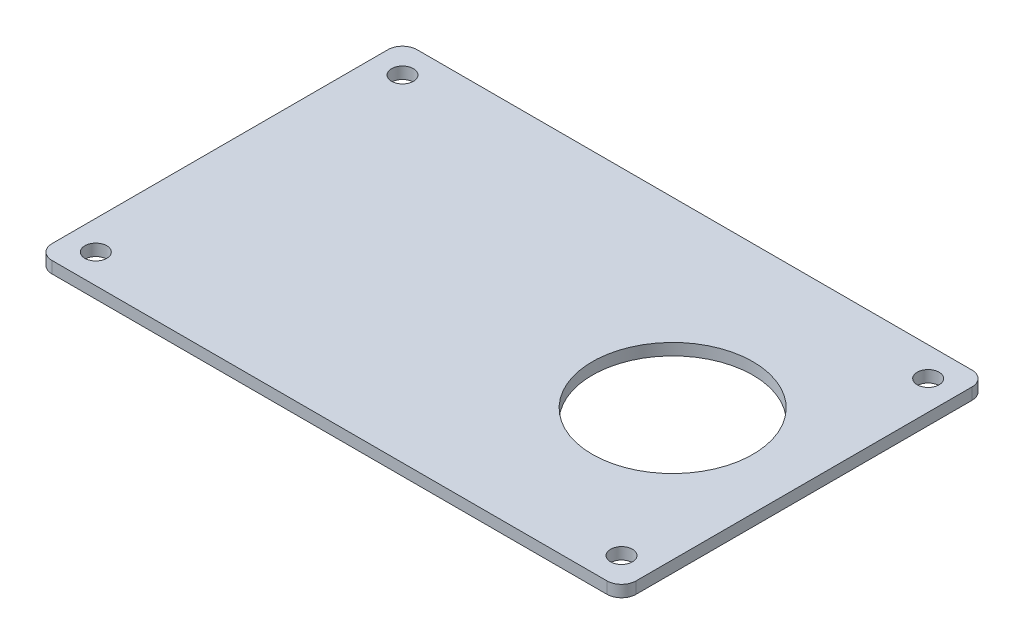
from build123d import *

# Parameters (mm, degrees)
SKETCH_1_W      = 80
SKETCH_1_H      = 50
SKETCH_1_R      = 1.5
SKETCH_1_R_2    = 11
EXTRUDE_1_DEPTH = 1.6
FILLET_1_R      = 2


with BuildPart() as part:
    # 草图1 → 凸台-拉伸1 (new body)
    with BuildSketch(Plane(origin=(0, 0, 0), x_dir=(1, 0, 0), z_dir=(0, 1, 0))):
        Rectangle(SKETCH_1_W, SKETCH_1_H)
        with Locations(Location((36, 21, 0), (0, 0, 270))):
            Circle(SKETCH_1_R, mode=Mode.SUBTRACT)
        with Locations(Location((36, -21, 0), (0, 0, 90))):
            Circle(SKETCH_1_R, mode=Mode.SUBTRACT)
        with Locations(Location((-36, -21, 0), (0, 0, 270))):
            Circle(SKETCH_1_R, mode=Mode.SUBTRACT)
        with Locations(Location((-36, 21, 0), (0, 0, 90))):
            Circle(SKETCH_1_R, mode=Mode.SUBTRACT)
        with Locations(Location((22, 0, 0), (0, 0, 270))):
            Circle(SKETCH_1_R_2, mode=Mode.SUBTRACT)
    extrude(amount=EXTRUDE_1_DEPTH)

    # 圆角1
    fillet_1_edges = [part.edges().sort_by_distance(p)[0] for p in [
        (40, 0.8, 25),
        (-40, 0.8, 25),
        (-40, 0.8, -25),
        (40, 0.8, -25),
    ]]
    fillet(fillet_1_edges, radius=FILLET_1_R)


solid = part.part
